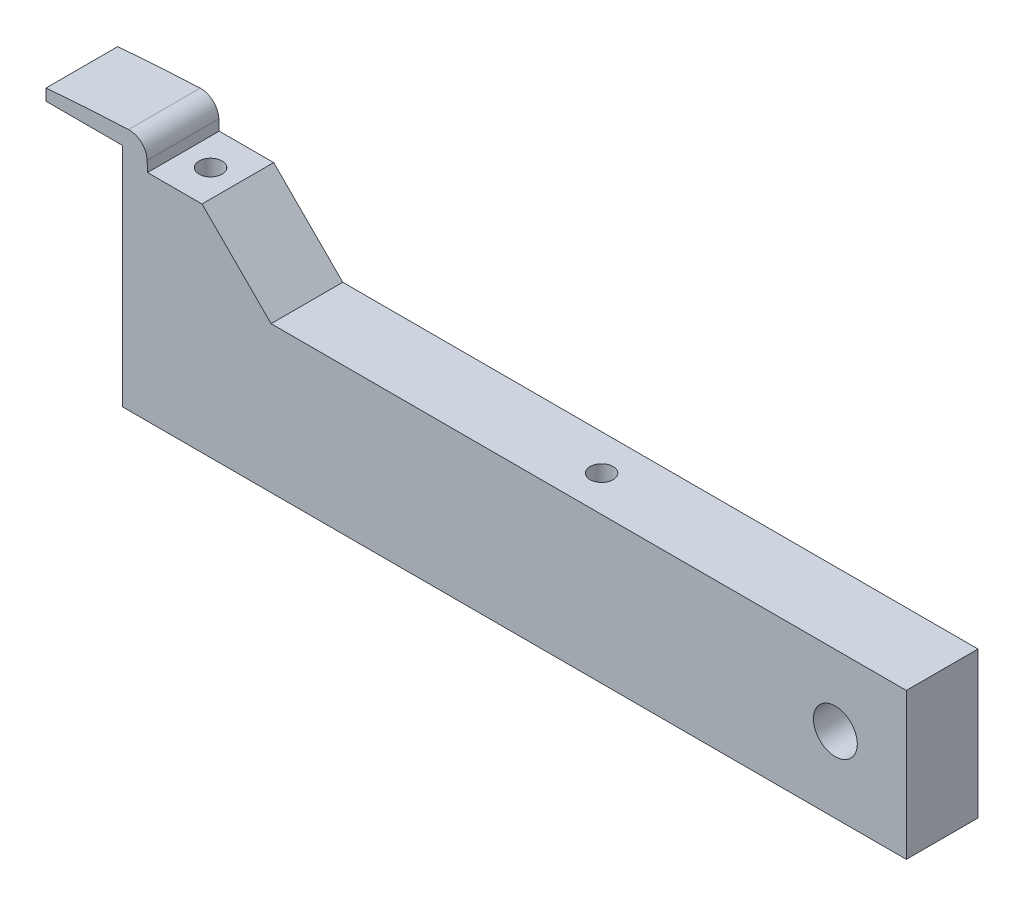
from build123d import *

# Parameters (mm, degrees)
SKETCH1_R           = 3.8862
BOSS_EXTRUDE1_DEPTH = 12.7
SKETCH2_R           = 2.032
CUT_EXTRUDE1_DEPTH  = 2688.829818218
SKETCH3_R           = 2.032
CUT_EXTRUDE2_DEPTH  = 2688.975736213


with BuildPart() as part:
    # Sketch1 → Boss-Extrude1 (new body)
    with BuildSketch(Plane.XY):
        with BuildLine():
            Line((2687.674805049, 2686.446487648), (2687.674805049, 2660.523843887))
            Line((2687.674805049, 2660.523843887), (2548.863805049, 2660.523843887))
            Line((2548.863805049, 2660.523843887), (2548.863805049, 2700.62861103))
            Line((2548.863805049, 2700.62861103), (2535.274805049, 2700.62861103))
            Line((2535.274805049, 2700.62861103), (2535.274805049, 2702.662667964))
            add(Edge.make_bspline(
                [(2549.887954959, 2703.598313804), (2545.009565075, 2703.390230841), (2540.136123501, 2703.088635053), (2535.274805049, 2702.662667964)],
                knots=[10.93644372, 10.93644372, 10.93644372, 10.93644372, 11.514330156, 11.514330156, 11.514330156, 11.514330156], degree=3))
            ThreePointArc((2549.887954959, 2703.598313804), (2552.182411528, 2702.754004596), (2553.196580638, 2700.529403507))
            Line((2553.196580638, 2700.529403507), (2553.256507729, 2698.686786983))
            Line((2553.256507729, 2698.686786983), (2562.908507729, 2698.686786983))
            Line((2562.908507729, 2698.686786983), (2575.148807064, 2686.446487648))
            Line((2575.148807064, 2686.446487648), (2687.674805049, 2686.446487648))
        make_face()
        with Locations((2675.105839614, 2673.877522213)):
            Circle(SKETCH1_R, mode=Mode.SUBTRACT)
    extrude(amount=BOSS_EXTRUDE1_DEPTH)

    # Sketch2 → Cut-Extrude1 (cut, through all)
    with BuildSketch(Plane(origin=(0, 2686.446487648, 0), x_dir=(1, 0, 0), z_dir=(0, 1, 0))):
        with Locations(Location((2627.349805049, -6.35, 0), (0, 0, 180))):
            Circle(SKETCH2_R)
    extrude(amount=-CUT_EXTRUDE1_DEPTH, mode=Mode.SUBTRACT)

    # Sketch3 → Cut-Extrude2 (cut, through all)
    with BuildSketch(Plane(origin=(0, 2698.686786983, 0), x_dir=(1, 0, 0), z_dir=(0, 1, 0))):
        with Locations(Location((2558.082507729, -6.35, 0), (0, 0, 180))):
            Circle(SKETCH3_R)
    extrude(amount=-CUT_EXTRUDE2_DEPTH, mode=Mode.SUBTRACT)


solid = part.part
